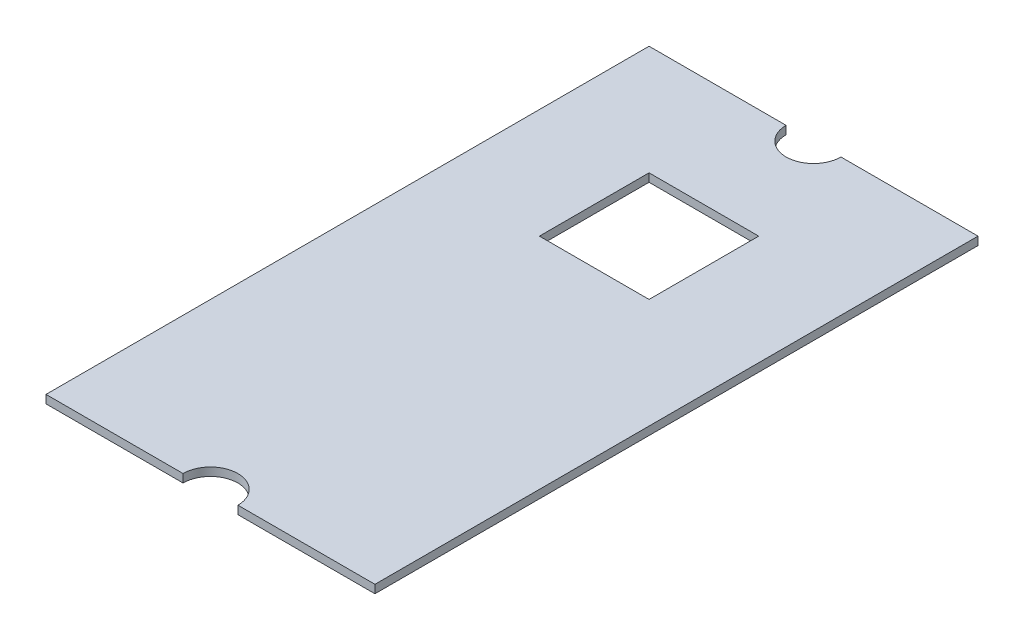
from build123d import *

# Parameters (mm, degrees)
SKETCH1_W           = 120
SKETCH1_H           = 3
BOSS_EXTRUDE1_DEPTH = 220
SKETCH2_R           = 10
CUT_EXTRUDE1_DEPTH  = 10
SKETCH4_W           = 40
SKETCH4_H           = 40
CUT_EXTRUDE2_DEPTH  = 10


with BuildPart() as part:
    # Sketch1 → Boss-Extrude1 (new body)
    with BuildSketch(Plane.XY):
        with Locations((60, 1.5)):
            Rectangle(SKETCH1_W, SKETCH1_H)
    extrude(amount=BOSS_EXTRUDE1_DEPTH)

    # Sketch2 → Cut-Extrude1 (cut)
    with BuildSketch(Plane(origin=(0, 3, 0), x_dir=(1, 0, 0), z_dir=(0, 1, 0))):
        with Locations((60, -220)):
            Circle(SKETCH2_R)
        with Locations((60, 0)):
            Circle(SKETCH2_R)
    extrude(amount=-CUT_EXTRUDE1_DEPTH, mode=Mode.SUBTRACT)

    # Sketch4 → Cut-Extrude2 (cut)
    with BuildSketch(Plane(origin=(0, 3, 0), x_dir=(1, 0, 0), z_dir=(0, 1, 0))):
        with Locations((60, -60)):
            Rectangle(SKETCH4_W, SKETCH4_H)
    extrude(amount=-CUT_EXTRUDE2_DEPTH, mode=Mode.SUBTRACT)


solid = part.part
